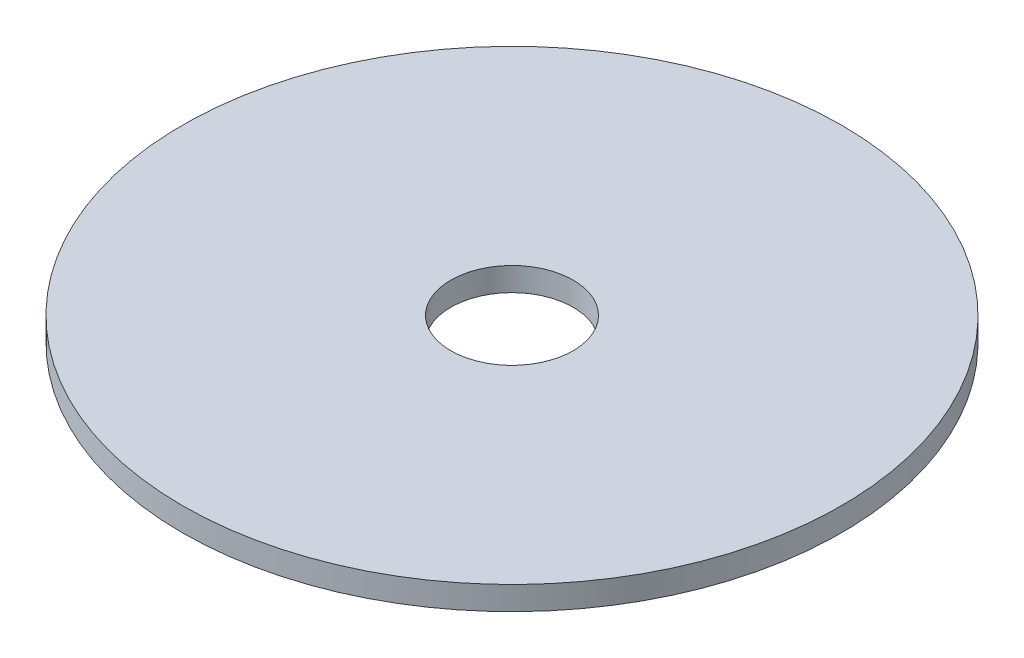
from build123d import *

# Parameters (mm, degrees)
IZIM1_R                     = 140
Y_KSEKLIK_EKSTR_ZYON1_DEPTH = 10
IZIM2_R                     = 26
KES_EKSTR_ZYON1_DEPTH       = 10


with BuildPart() as part:
    # Çizim1 → Yükseklik-Ekstrüzyon1 (new body)
    with BuildSketch(Plane(origin=(0, 0, 0), x_dir=(1, 0, 0), z_dir=(0, 1, 0))):
        with Locations(Location((0, 0, 0), (0, 0, 270))):
            Circle(IZIM1_R)
    extrude(amount=Y_KSEKLIK_EKSTR_ZYON1_DEPTH)

    # Çizim2 → Kes-Ekstrüzyon1 (cut)
    with BuildSketch(Plane(origin=(0, 10, 0), x_dir=(1, 0, 0), z_dir=(0, 1, 0))):
        with Locations(Location((0, 0, 0), (0, 0, 270))):
            Circle(IZIM2_R)
    extrude(amount=-KES_EKSTR_ZYON1_DEPTH, mode=Mode.SUBTRACT)


solid = part.part
